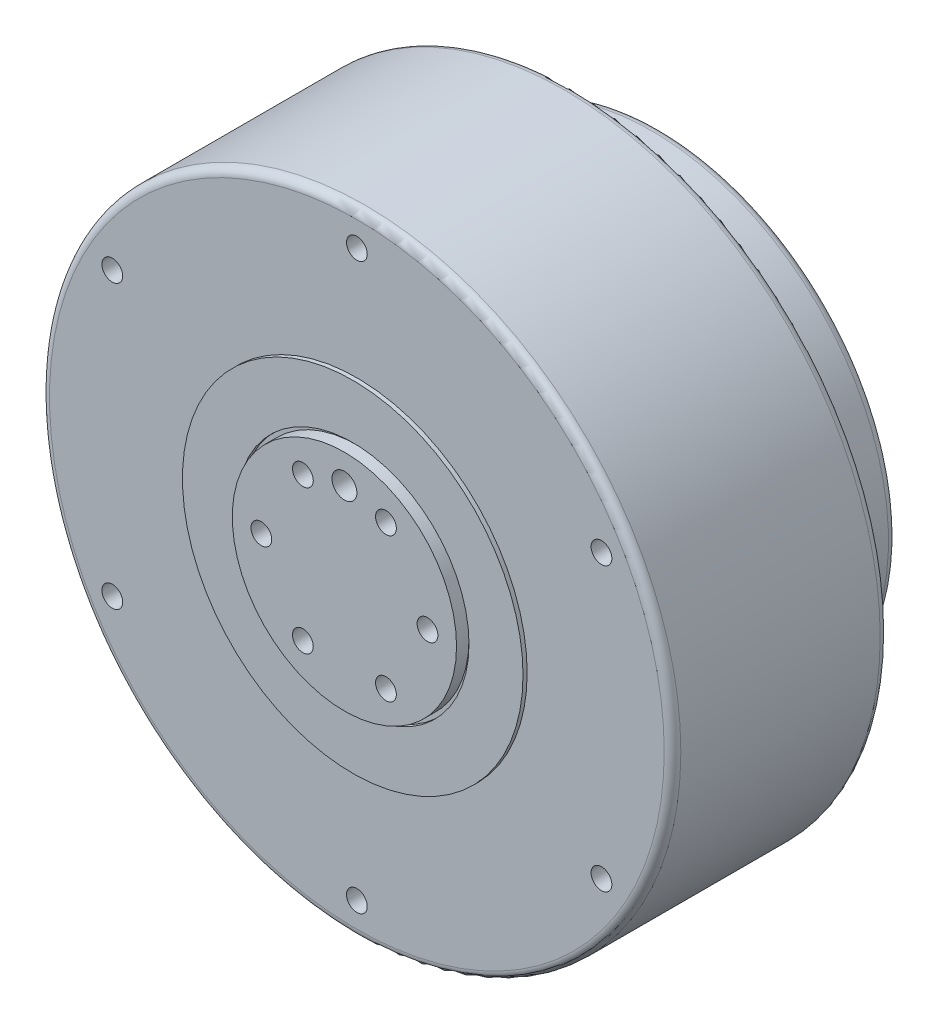
from build123d import *

# Parameters (mm, degrees)
IZIM2_R                     = 38
Y_KSEKLIK_EKSTR_ZYON1_DEPTH = 13
Y_KSEKLIK_EKSTR_ZYON2_DEPTH = 10.5
IZIM4_R                     = 20.5
IZIM4_R_2                   = 14
Y_KSEKLIK_EKSTR_ZYON3_DEPTH = 0.5
IZIM5_R                     = 13.5
Y_KSEKLIK_EKSTR_ZYON4_DEPTH = 1.5
F_2_5_2_5_AP_DELIK1_D       = 2.5
F_2_5_2_5_AP_DELIK1_DEPTH   = 3
F_2_5_2_5_AP_DELIK1_TIP     = 0.751075774
F_2_5_2_5_AP_DELIK2_D       = 2.5
F_2_5_2_5_AP_DELIK2_DEPTH   = 3
F_2_5_2_5_AP_DELIK2_TIP     = 0.751075774
F_2_5_2_5_AP_DELIK3_D       = 2.5
F_2_5_2_5_AP_DELIK3_DEPTH   = 5
F_2_5_2_5_AP_DELIK3_TIP     = 0.751075774
F_3_0_3_AP_DELIK1_D         = 3
F_3_0_3_AP_DELIK1_DEPTH     = 3
F_3_0_3_AP_DELIK1_TIP       = 0.901290929
RADYUS1_R                   = 1


with BuildPart() as part:
    # Çizim2 → Yükseklik-Ekstrüzyon1 (new, symmetric)
    with BuildSketch(Plane.XY):
        with Locations(Location((0, 0, 0), (0, 0, 180))):
            Circle(IZIM2_R)
    extrude(amount=Y_KSEKLIK_EKSTR_ZYON1_DEPTH, both=True)

    # Çizim3 → Yükseklik-Ekstrüzyon2 (add)
    with BuildSketch(Plane(origin=(0, 0, -13), x_dir=(-1, 0, 0), z_dir=(0, 0, -1))):
        with BuildLine():
            Line((-10.488088482, -26.5), (10.488088482, -26.5))
            ThreePointArc((10.488088482, -26.5), (0, 28.5), (-10.488088482, -26.5))
        make_face()
    extrude(amount=Y_KSEKLIK_EKSTR_ZYON2_DEPTH)

    # Çizim4 → Yükseklik-Ekstrüzyon3 (add)
    with BuildSketch(Plane.XY.offset(13)):
        Circle(IZIM4_R)
        Circle(IZIM4_R_2, mode=Mode.SUBTRACT)
    extrude(amount=Y_KSEKLIK_EKSTR_ZYON3_DEPTH)

    # Çizim5 → Yükseklik-Ekstrüzyon4 (add)
    with BuildSketch(Plane.XY.offset(13)):
        Circle(IZIM5_R)
    extrude(amount=Y_KSEKLIK_EKSTR_ZYON4_DEPTH)

    # Ø2.5 (2.5) Çap Delik1
    with Locations(Plane(origin=(0, 34, 13), x_dir=(1, 0, 0), z_dir=(0, 0, 1))):
        with Locations((0, 0), (29.444863729, -17), (-29.444863729, -17), (-29.444863729, -51), (0, -68), (29.444863729, -51)):
            Hole(F_2_5_2_5_AP_DELIK1_D / 2, depth=F_2_5_2_5_AP_DELIK1_DEPTH)
            with Locations((0, 0, -(F_2_5_2_5_AP_DELIK1_DEPTH + F_2_5_2_5_AP_DELIK1_TIP / 2))):  # 118° drill point
                Cone(0, F_2_5_2_5_AP_DELIK1_D / 2, F_2_5_2_5_AP_DELIK1_TIP, mode=Mode.SUBTRACT)

    # Ø2.5 (2.5) Çap Delik2
    with Locations(Plane(origin=(0, 34, -13), x_dir=(-1, 0, 0), z_dir=(0, 0, -1))):
        with Locations((0, 0), (-29.444863729, -17), (-29.444863729, -51), (0, -68), (29.444863729, -51), (29.444863729, -17)):
            Hole(F_2_5_2_5_AP_DELIK2_D / 2, depth=F_2_5_2_5_AP_DELIK2_DEPTH)
            with Locations((0, 0, -(F_2_5_2_5_AP_DELIK2_DEPTH + F_2_5_2_5_AP_DELIK2_TIP / 2))):  # 118° drill point
                Cone(0, F_2_5_2_5_AP_DELIK2_D / 2, F_2_5_2_5_AP_DELIK2_TIP, mode=Mode.SUBTRACT)

    # Ø2.5 (2.5) Çap Delik3
    with Locations(Plane(origin=(-10, 0, 14.5), x_dir=(1, 0, 0), z_dir=(0, 0, 1))):
        with Locations((0, 0), (5, 8.660254038), (15, 8.660254038), (20, 0), (15, -8.660254038), (5, -8.660254038)):
            Hole(F_2_5_2_5_AP_DELIK3_D / 2, depth=F_2_5_2_5_AP_DELIK3_DEPTH)
            with Locations((0, 0, -(F_2_5_2_5_AP_DELIK3_DEPTH + F_2_5_2_5_AP_DELIK3_TIP / 2))):  # 118° drill point
                Cone(0, F_2_5_2_5_AP_DELIK3_D / 2, F_2_5_2_5_AP_DELIK3_TIP, mode=Mode.SUBTRACT)

    # Ø3.0 (3) Çap Delik1
    with Locations(Plane(origin=(0, 10, 14.5), x_dir=(1, 0, 0), z_dir=(0, 0, 1))):
        with Locations((0, 0)):
            Hole(F_3_0_3_AP_DELIK1_D / 2, depth=F_3_0_3_AP_DELIK1_DEPTH)
            with Locations((0, 0, -(F_3_0_3_AP_DELIK1_DEPTH + F_3_0_3_AP_DELIK1_TIP / 2))):  # 118° drill point
                Cone(0, F_3_0_3_AP_DELIK1_D / 2, F_3_0_3_AP_DELIK1_TIP, mode=Mode.SUBTRACT)

    # Radyus1
    radyus1_edges = [part.edges().sort_by_distance(p)[0] for p in [
        (38, 0, -13),
        (38, 0, 13),
        (0, 28.5, -23.5),
        (0, -26.5, -23.5),
    ]]
    fillet(radyus1_edges, radius=RADYUS1_R)


solid = part.part
